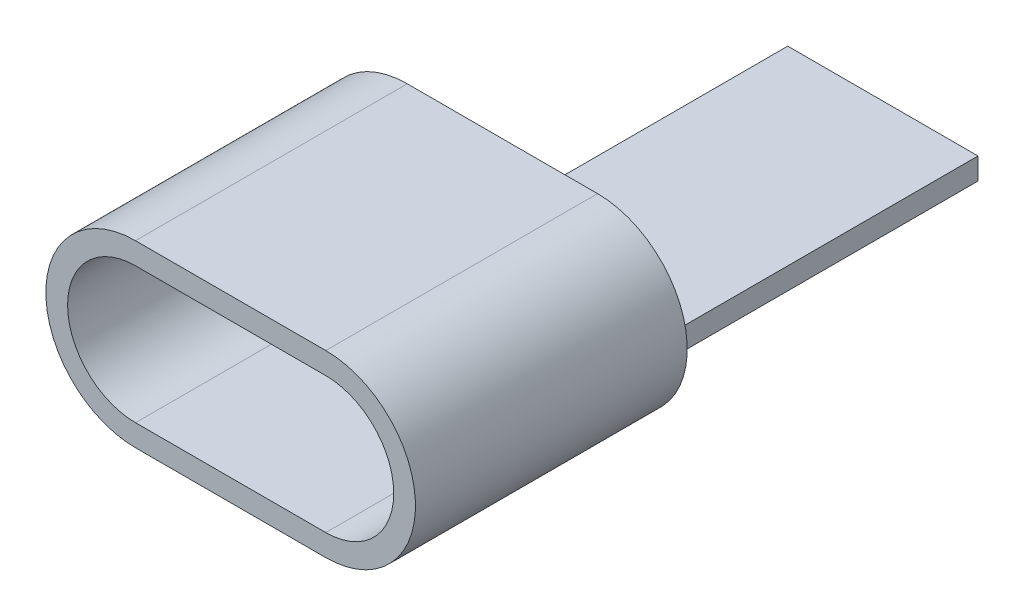
from build123d import *

# Parameters (mm, degrees)
SKETCH1_W           = 14
SKETCH1_H           = 28
BOSS_EXTRUDE1_DEPTH = 1.6
SKETCH2_W           = 14
SKETCH2_H           = 1.6
BOSS_EXTRUDE2_DEPTH = 20


with BuildPart() as part:
    # Sketch1 → Boss-Extrude1 (new body)
    with BuildSketch(Plane(origin=(0, 0, 0), x_dir=(1, 0, 0), z_dir=(0, 1, 0))):
        with Locations((0, 14)):
            Rectangle(SKETCH1_W, SKETCH1_H)
    extrude(amount=BOSS_EXTRUDE1_DEPTH)

    # Sketch2 → Boss-Extrude2 (add)
    with BuildSketch(Plane.XY):
        with BuildLine():
            Line((-7, 13.2), (7, 13.2))
            ThreePointArc((7, 13.2), (13.6, 6.6), (7, 0))
            Line((7, 0), (7, 1.6))
            ThreePointArc((7, 1.6), (12, 6.6), (7, 11.6))
            Line((7, 11.6), (-7, 11.6))
            ThreePointArc((-7, 11.6), (-12, 6.6), (-7, 1.6))
            Line((-7, 1.6), (-7, 0))
            ThreePointArc((-7, 0), (-13.6, 6.6), (-7, 13.2))
        make_face()
        with Locations((0, 0.8)):
            Rectangle(SKETCH2_W, SKETCH2_H)
    extrude(amount=BOSS_EXTRUDE2_DEPTH)


solid = part.part
